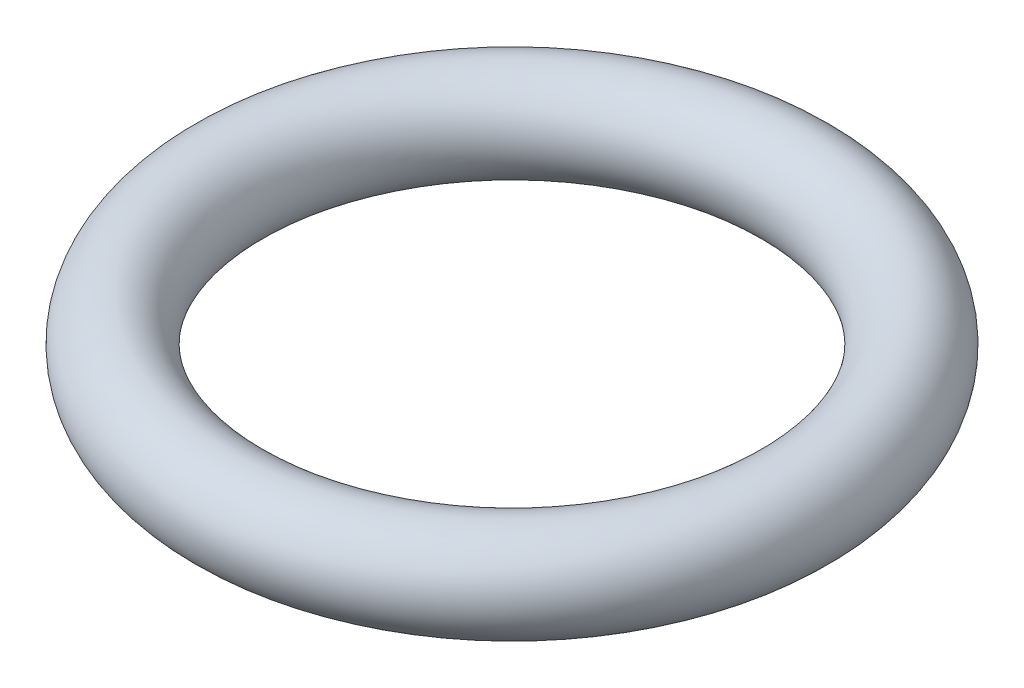
from build123d import *

# Parameters (mm, degrees)
SKETCH1_R = 25.4


with BuildPart() as part:
    # Sketch1 → Revolve1 (revolve)
    with BuildSketch(Plane(origin=(0, 0, 0), x_dir=(0, 0, -1), z_dir=(1, 0, 0)), mode=Mode.PRIVATE) as revolve1_sk:
        with Locations((-152.4, 0)):
            Circle(SKETCH1_R)
    revolve(revolve1_sk.sketch.rotate(Axis((0, -77.331101162, 0), (0, 1, 0)), 180), axis=Axis((0, -77.331101162, 0), (0, 1, 0)))


solid = part.part
